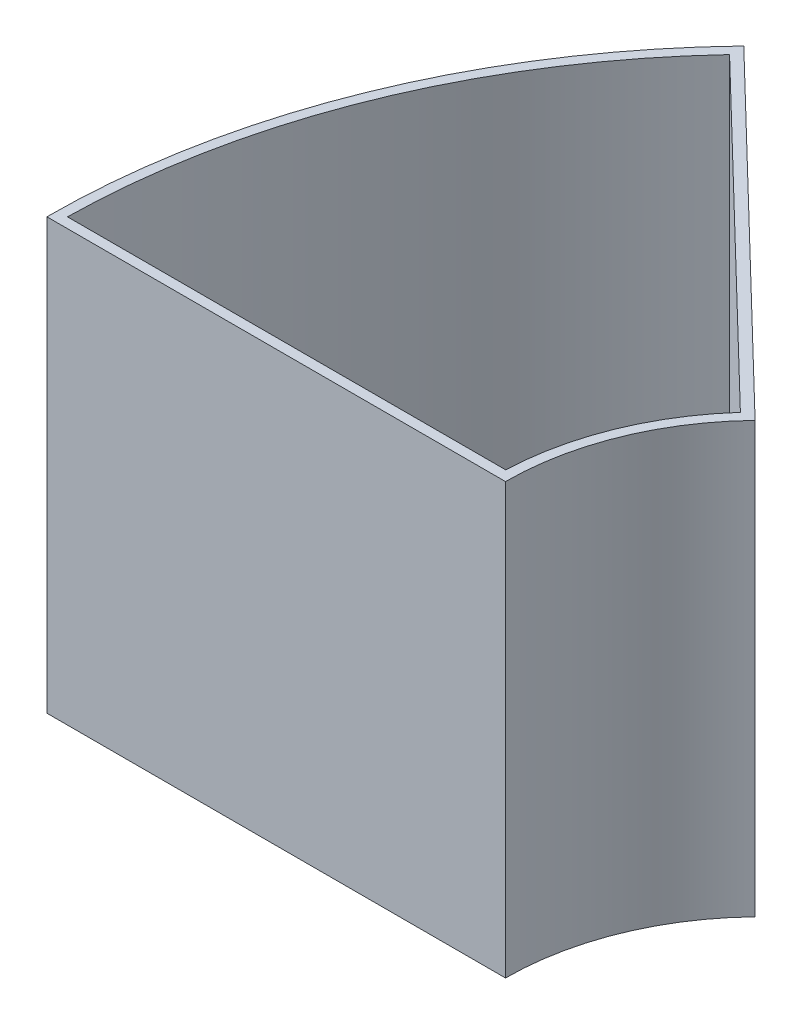
from build123d import *

# Parameters (mm, degrees)
SALIENTE_EXTRUIR1_DEPTH = 40
VACIADO1_T              = -1
SALIENTE_EXTRUIR3_START = 2
SALIENTE_EXTRUIR3_DEPTH = 2
CORTAR_EXTRUIR1_DEPTH   = 2
CROQUIS5_R              = 2.5
CORTAR_EXTRUIR2_DEPTH   = 2


with BuildPart() as part:
    # Croquis1 → Saliente-Extruir1 (new body)
    with BuildSketch(Plane(origin=(0, 0, 0), x_dir=(1, 0, 0), z_dir=(0, 1, 0))):
        with BuildLine():
            Line((-25, 0), (-69.8, 0))
            ThreePointArc((-69.8, 0), (-64.717433049, 26.14754022), (-50.209918064, 48.487154258))
            Line((-50.209918064, 48.487154258), (-17.983495008, 17.366459261))
            ThreePointArc((-17.983495008, 17.366459261), (-23.179596364, 9.365164835), (-25, 0))
        make_face()
    extrude(amount=SALIENTE_EXTRUIR1_DEPTH)

    # Vaciado1
    vaciado1_openings = [part.faces().sort_by_distance(p)[0] for p in [
        (-46.068338787, 40, -18.61281705),
    ]]
    offset(amount=VACIADO1_T, openings=vaciado1_openings, kind=Kind.INTERSECTION)

    # Croquis4 → Saliente-Extruir3 (add)
    with BuildSketch(Plane.XZ.offset(SALIENTE_EXTRUIR3_START)):
        with BuildLine():
            Line((-25, 0), (-69.8, 0))
            ThreePointArc((-69.8, 0), (-64.717433049, -26.14754022), (-50.209918064, -48.487154258))
            Line((-50.209918064, -48.487154258), (-17.983495008, -17.366459261))
            ThreePointArc((-17.983495008, -17.366459261), (-23.179596364, -9.365164835), (-25, 0))
        make_face()
    extrude(amount=-SALIENTE_EXTRUIR3_DEPTH)

    # Croquis2 → Cortar-Extruir1 (cut)
    with BuildSketch(Plane(origin=(0, -2, 0), x_dir=(1, 0, 0), z_dir=(0, 1, 0))):
        with BuildLine():
            Line((-38.909722104, 27.244880727), (-30.718201661, 21.509116363))
            ThreePointArc((-30.718201661, 21.509116363), (-34.769394546, 14.047747253), (-37.038312772, 5.866292439))
            Line((-37.038312772, 5.866292439), (-46.915196178, 7.430637089))
            ThreePointArc((-46.915196178, 7.430637089), (-44.041233092, 17.793813187), (-38.909722104, 27.244880727))
        make_face()
    extrude(amount=CORTAR_EXTRUIR1_DEPTH, mode=Mode.SUBTRACT)

    # Croquis5 → Cortar-Extruir2 (cut)
    with BuildSketch(Plane(origin=(0, 1, 0), x_dir=(1, 0, 0), z_dir=(0, 1, 0))):
        with Locations(Location((-55.631031274, 22.476395605, 0), (0, 0, 270))):
            Circle(CROQUIS5_R)
    extrude(amount=-CORTAR_EXTRUIR2_DEPTH, mode=Mode.SUBTRACT)


solid = part.part
